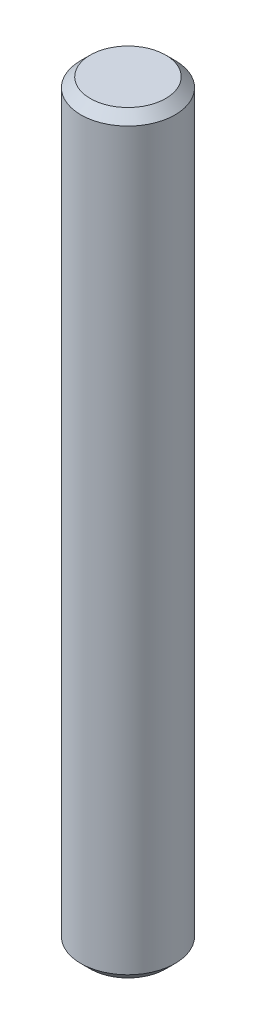
from build123d import *

# Parameters (mm, degrees)
CHAMFER_1_SIZE = 1


with BuildPart() as part:
    # 草图1 → 旋转1 (revolve)
    with BuildSketch(Plane.XY, mode=Mode.PRIVATE) as revolve_1_sk:
        Polygon((0, 40), (5, 40), (5, 30), (5, -30), (5, -40), (0, -40), align=None)
    revolve(revolve_1_sk.sketch.rotate(Axis((0, 40, 0), (0, -1, 0)), 180), axis=Axis((0, 40, 0), (0, -1, 0)))

    # 倒角1
    chamfer_1_edges = [part.edges().sort_by_distance(p)[0] for p in [
        (5, -40, 0),
        (5, 40, 0),
    ]]
    chamfer(chamfer_1_edges, length=CHAMFER_1_SIZE)


solid = part.part
